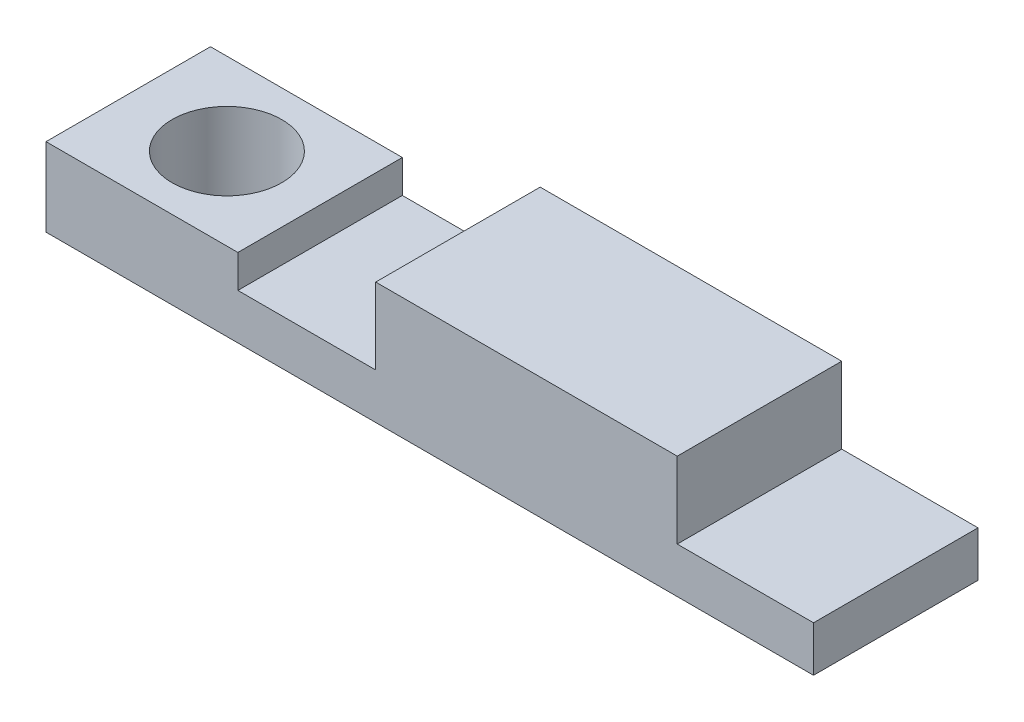
from build123d import *

# Parameters (mm, degrees)
SKETCH1_W               = 140
SKETCH1_H               = 30
BOSS_EXTRUDE1_DEPTH     = 8.3
SKETCH3_W               = 35
SKETCH3_H               = 30
BOSS_EXTRUDE2_DEPTH     = 6
CUT_EXTRUDE1_DEPTH      = 6
CUT_EXTRUDE1_DEPTH_BACK = 8.3
SKETCH2_R               = 10
SKETCH4_W               = 55
SKETCH4_H               = 30
BOSS_EXTRUDE3_DEPTH     = 3.89
SKETCH5_R               = 10
CUT_EXTRUDE2_DEPTH      = 144.890548682
SKETCH7_W               = 55
SKETCH7_H               = 30
BOSS_EXTRUDE4_DEPTH     = 10


with BuildPart() as part:
    # Sketch1 → Boss-Extrude1 (new body)
    with BuildSketch(Plane(origin=(0, 0, 0), x_dir=(1, 0, 0), z_dir=(0, 1, 0))):
        with Locations((70, 15)):
            Rectangle(SKETCH1_W, SKETCH1_H)
    extrude(amount=BOSS_EXTRUDE1_DEPTH)

    # Sketch3 → Boss-Extrude2 (add)
    with BuildSketch(Plane(origin=(0, 8.3, 0), x_dir=(1, 0, 0), z_dir=(0, 1, 0))):
        with Locations((17.5, 15)):
            Rectangle(SKETCH3_W, SKETCH3_H)
    extrude(amount=BOSS_EXTRUDE2_DEPTH)

    # Sketch2 → Cut-Extrude1 (cut, two sides: drawn at the far end of the back side and taken through both)
    with BuildSketch(Plane(origin=(0, 8.3, 0), x_dir=(1, 0, 0), z_dir=(0, 1, 0)).offset(-CUT_EXTRUDE1_DEPTH_BACK)):
        with Locations(Location((18, 15, 0), (0, 0, 270))):
            Circle(SKETCH2_R)
        with Locations(Location((80.14, 15, 0), (0, 0, 90))):
            Circle(SKETCH2_R)
    extrude(amount=CUT_EXTRUDE1_DEPTH + CUT_EXTRUDE1_DEPTH_BACK, mode=Mode.SUBTRACT)

    # Sketch4 → Boss-Extrude3 (add)
    with BuildSketch(Plane(origin=(0, 8.3, 0), x_dir=(1, 0, 0), z_dir=(0, 1, 0))):
        with Locations((87.64, 15)):
            Rectangle(SKETCH4_W, SKETCH4_H)
    extrude(amount=BOSS_EXTRUDE3_DEPTH)

    # Sketch5 → Cut-Extrude2 (cut, through all)
    with BuildSketch(Plane.XZ):
        with Locations(Location((80.14, -15, 0), (0, 0, 90))):
            Circle(SKETCH5_R)
    extrude(amount=-CUT_EXTRUDE2_DEPTH, mode=Mode.SUBTRACT)

    # Sketch7 → Boss-Extrude4 (add)
    with BuildSketch(Plane(origin=(0, 12.19, 0), x_dir=(1, 0, 0), z_dir=(0, 1, 0))):
        with Locations((87.64, 15)):
            Rectangle(SKETCH7_W, SKETCH7_H)
    extrude(amount=BOSS_EXTRUDE4_DEPTH)


solid = part.part
